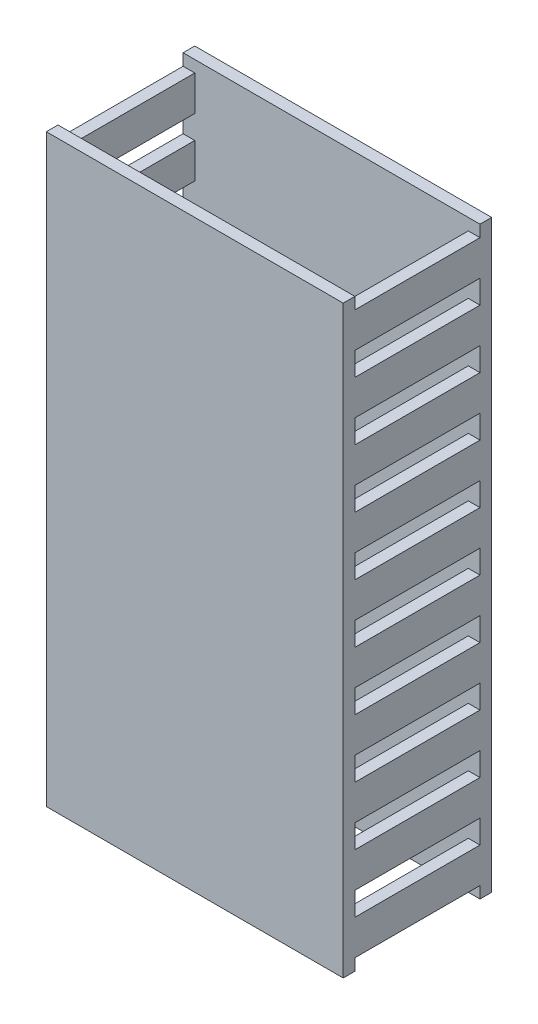
from build123d import *

# Parameters (mm, degrees)
SKETCH1_W           = 50.8
SKETCH1_H           = 25.4
SKETCH1_W_2         = 46.8
SKETCH1_H_2         = 21.4
BOSS_EXTRUDE1_DEPTH = 50
SKETCH2_W           = 21.4
SKETCH2_H           = 4
CUT_EXTRUDE1_DEPTH  = 76.669016116
LPATTERN1_COUNT     = 6
LPATTERN1_PITCH     = 10
LPATTERN1_COL_COUNT = 6
LPATTERN1_COL_PITCH = 10


with BuildPart() as part:
    # Sketch1 → Boss-Extrude1 (new, symmetric)
    with BuildSketch(Plane(origin=(0, 0, 0), x_dir=(1, 0, 0), z_dir=(0, 1, 0))):
        with Locations((25.4, 12.7)):
            Rectangle(SKETCH1_W, SKETCH1_H)
        with Locations((25.4, 12.7)):
            Rectangle(SKETCH1_W_2, SKETCH1_H_2, mode=Mode.SUBTRACT)
    extrude(amount=BOSS_EXTRUDE1_DEPTH, both=True)

    # Sketch2 → Cut-Extrude1 (cut, through all)
    with BuildSketch(Plane(origin=(50.8, 0, 0), x_dir=(0, 0, -1), z_dir=(1, 0, 0))):
        with Locations((12.7, 0)):
            Rectangle(SKETCH2_W, SKETCH2_H)
    cut_extrude1 = extrude(amount=-CUT_EXTRUDE1_DEPTH, mode=Mode.SUBTRACT)

    # LPattern1: Cut-Extrude1 ×6
    with Locations(*[(0, -i * LPATTERN1_PITCH, 0) for i in range(1, LPATTERN1_COUNT)]):
        add(cut_extrude1, mode=Mode.SUBTRACT)

    # LPattern1 col: Cut-Extrude1 ×6
    with Locations(*[(0, i * LPATTERN1_COL_PITCH, 0) for i in range(1, LPATTERN1_COL_COUNT)]):
        add(cut_extrude1, mode=Mode.SUBTRACT)


solid = part.part
